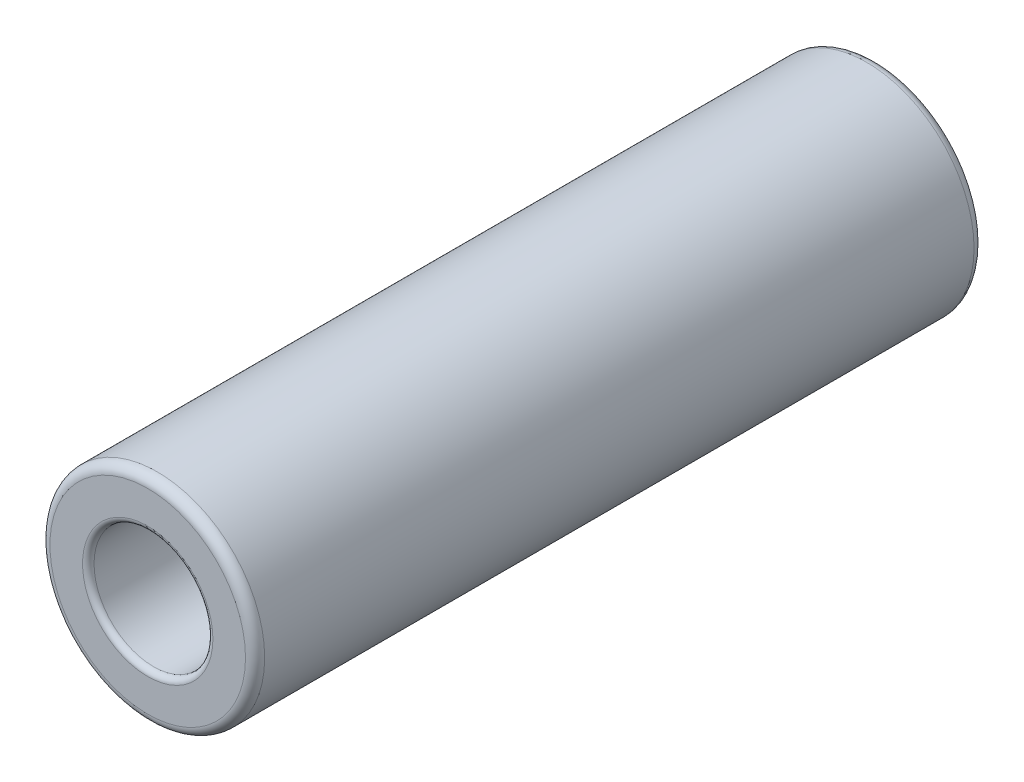
from build123d import *

# Parameters (mm, degrees)
SKETCH1_R           = 14.224
SKETCH1_R_2         = 7.874
BOSS_EXTRUDE1_DEPTH = 96.52
FILLET1_R           = 1.27
FILLET2_R           = 0.762


with BuildPart() as part:
    # Sketch1 → Boss-Extrude1 (new body)
    with BuildSketch(Plane.XY):
        with Locations(Location((0, 0, 0), (0, 0, 180))):
            Circle(SKETCH1_R)
        with Locations(Location((0, 0, 0), (0, 0, 180))):
            Circle(SKETCH1_R_2, mode=Mode.SUBTRACT)
    extrude(amount=BOSS_EXTRUDE1_DEPTH)

    # Fillet1
    fillet1_edges = [part.edges().sort_by_distance(p)[0] for p in [
        (14.224, 0, 0),
        (14.224, 0, 96.52),
    ]]
    fillet(fillet1_edges, radius=FILLET1_R)

    # Fillet2
    fillet2_edges = [part.edges().sort_by_distance(p)[0] for p in [
        (7.874, 0, 0),
        (7.874, 0, 96.52),
    ]]
    fillet(fillet2_edges, radius=FILLET2_R)


solid = part.part
